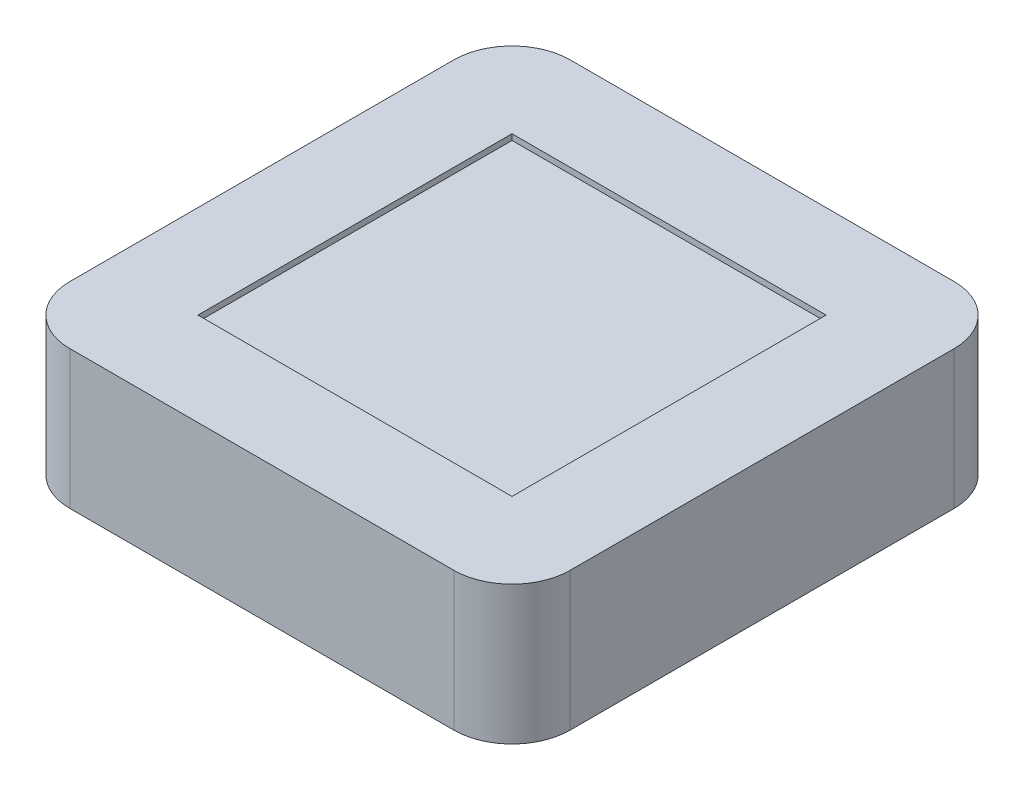
from build123d import *

# Parameters (mm, degrees)
CROQUIS1_W              = 43
CROQUIS1_H              = 43
SALIENTE_EXTRUIR1_DEPTH = 11.9
CROQUIS2_W              = 27
CROQUIS2_H              = 27
CORTAR_EXTRUIR1_DEPTH   = 0.5
REDONDEO1_R             = 5


with BuildPart() as part:
    # Croquis1 → Saliente-Extruir1 (new body)
    with BuildSketch(Plane(origin=(0, 0, 0), x_dir=(1, 0, 0), z_dir=(0, 1, 0))):
        with Locations((21.5, 21.5)):
            Rectangle(CROQUIS1_W, CROQUIS1_H)
    extrude(amount=SALIENTE_EXTRUIR1_DEPTH)

    # Croquis2 → Cortar-Extruir1 (cut)
    with BuildSketch(Plane(origin=(0, 11.9, 0), x_dir=(1, 0, 0), z_dir=(0, 1, 0))):
        with Locations((21.5, 21.5)):
            Rectangle(CROQUIS2_W, CROQUIS2_H)
    extrude(amount=-CORTAR_EXTRUIR1_DEPTH, mode=Mode.SUBTRACT)

    # Redondeo1
    redondeo1_edges = [part.edges().sort_by_distance(p)[0] for p in [
        (0, 5.95, -43),
        (43, 5.95, -43),
        (43, 5.95, 0),
        (0, 5.95, 0),
    ]]
    fillet(redondeo1_edges, radius=REDONDEO1_R)


solid = part.part
